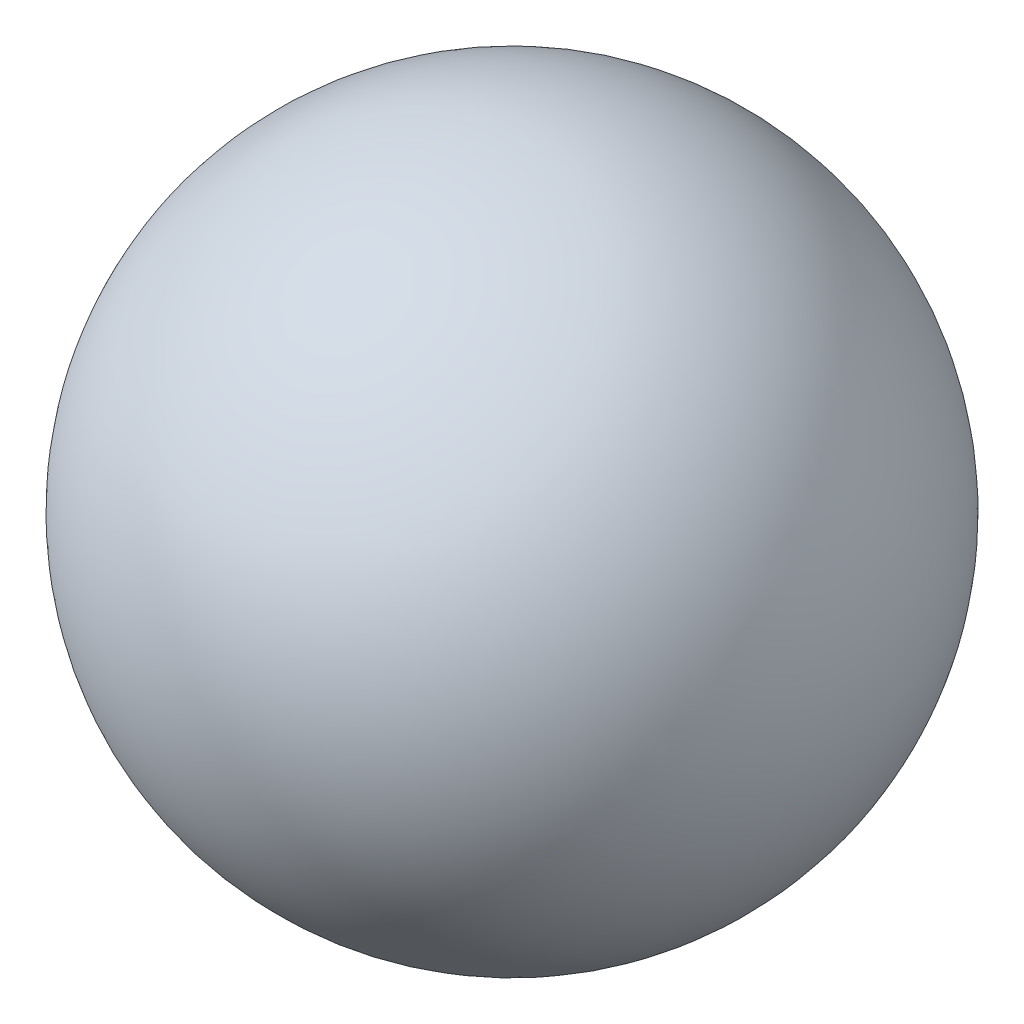
from build123d import *


with BuildPart() as part:
    # Sketch1 → Revolve1 (revolve)
    with BuildSketch(Plane(origin=(0, 0, 0), x_dir=(1, 0, 0), z_dir=(0, 1, 0))):
        with BuildLine():
            Line((0, 0), (42.672, 0))
            ThreePointArc((42.672, 0), (21.336, -21.336), (0, 0))
        make_face()
    revolve(axis=Axis((0, 0, 0), (1, 0, 0)))


solid = part.part
